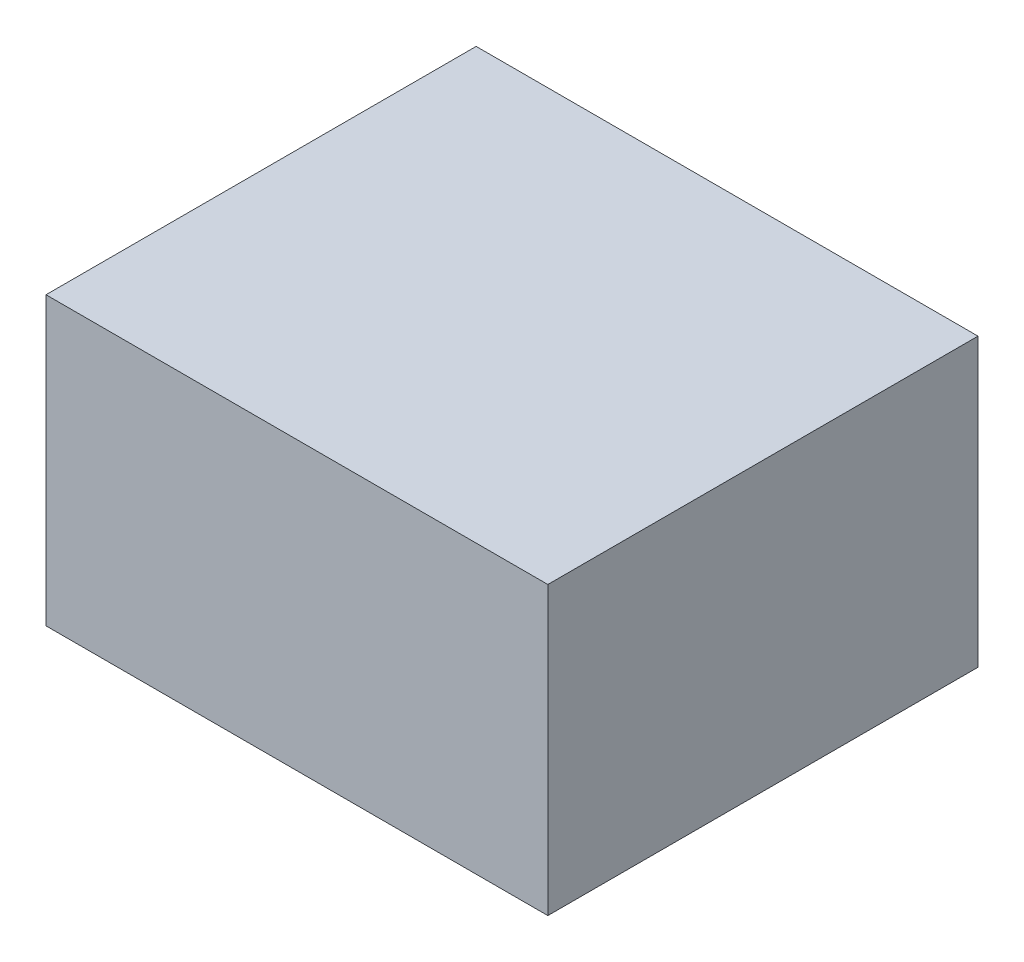
from build123d import *

# Parameters (mm, degrees)
SK_P01_SPLICEBLOCK_W  = 14
SK_P01_SPLICEBLOCK_H  = 12
P01_SPLICEBLOCK_DEPTH = 8


with BuildPart() as part:
    # SK_P01_Spliceblock → P01_Spliceblock (new body)
    with BuildSketch(Plane(origin=(0, 0, 0), x_dir=(1, 0, 0), z_dir=(0, 1, 0))):
        Rectangle(SK_P01_SPLICEBLOCK_W, SK_P01_SPLICEBLOCK_H)
    extrude(amount=P01_SPLICEBLOCK_DEPTH)


solid = part.part
